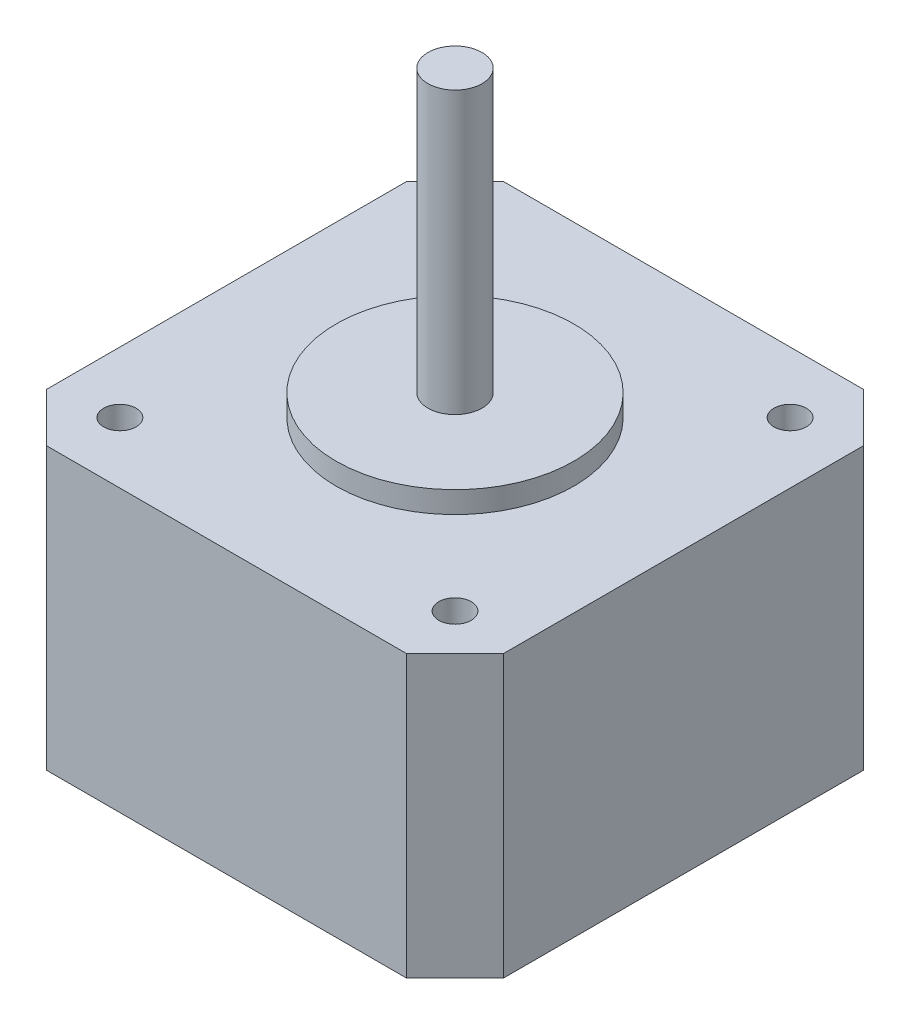
from build123d import *

# Parameters (mm, degrees)
AUFSATZ_LINEAR_AUSTRAGEN1_DEPTH = 26
SKIZZE2_R                       = 11
AUFSATZ_LINEAR_AUSTRAGEN2_DEPTH = 2
SKIZZE3_R                       = 2.5
AUFSATZ_LINEAR_AUSTRAGEN3_DEPTH = 26
SKIZZE4_R                       = 1.5
SCHNITT_LINEAR_AUSTRAGEN1_DEPTH = 4.5


with BuildPart() as part:
    # Skizze1 → Aufsatz-Linear austragen1 (new body)
    with BuildSketch(Plane(origin=(0, 0, 0), x_dir=(1, 0, 0), z_dir=(0, 1, 0))):
        Polygon((0, 37.8), (4.5, 42.3), (37.8, 42.3), (42.3, 37.8), (42.3, 4.5), (37.8, 0), (4.5, 0), (0, 4.5), align=None)
    extrude(amount=AUFSATZ_LINEAR_AUSTRAGEN1_DEPTH)

    # Skizze2 → Aufsatz-Linear austragen2 (add)
    with BuildSketch(Plane(origin=(0, 26, 0), x_dir=(1, 0, 0), z_dir=(0, 1, 0))):
        with Locations(Location((21.15, 21.15, 0), (0, 0, 270))):
            Circle(SKIZZE2_R)
    extrude(amount=AUFSATZ_LINEAR_AUSTRAGEN2_DEPTH)

    # Skizze3 → Aufsatz-Linear austragen3 (add)
    with BuildSketch(Plane(origin=(0, 28, 0), x_dir=(1, 0, 0), z_dir=(0, 1, 0))):
        with Locations(Location((21.15, 21.15, 0), (0, 0, 90))):
            Circle(SKIZZE3_R)
    extrude(amount=AUFSATZ_LINEAR_AUSTRAGEN3_DEPTH)

    # Skizze4 → Schnitt-Linear austragen1 (cut)
    with BuildSketch(Plane(origin=(0, 26, 0), x_dir=(1, 0, 0), z_dir=(0, 1, 0))):
        with Locations(Location((5.65, 36.65, 0), (0, 0, 270))):
            Circle(SKIZZE4_R)
        with Locations(Location((36.65, 36.65, 0), (0, 0, 270))):
            Circle(SKIZZE4_R)
        with Locations(Location((5.65, 5.65, 0), (0, 0, 90))):
            Circle(SKIZZE4_R)
        with Locations(Location((36.65, 5.65, 0), (0, 0, 90))):
            Circle(SKIZZE4_R)
    extrude(amount=-SCHNITT_LINEAR_AUSTRAGEN1_DEPTH, mode=Mode.SUBTRACT)


solid = part.part
